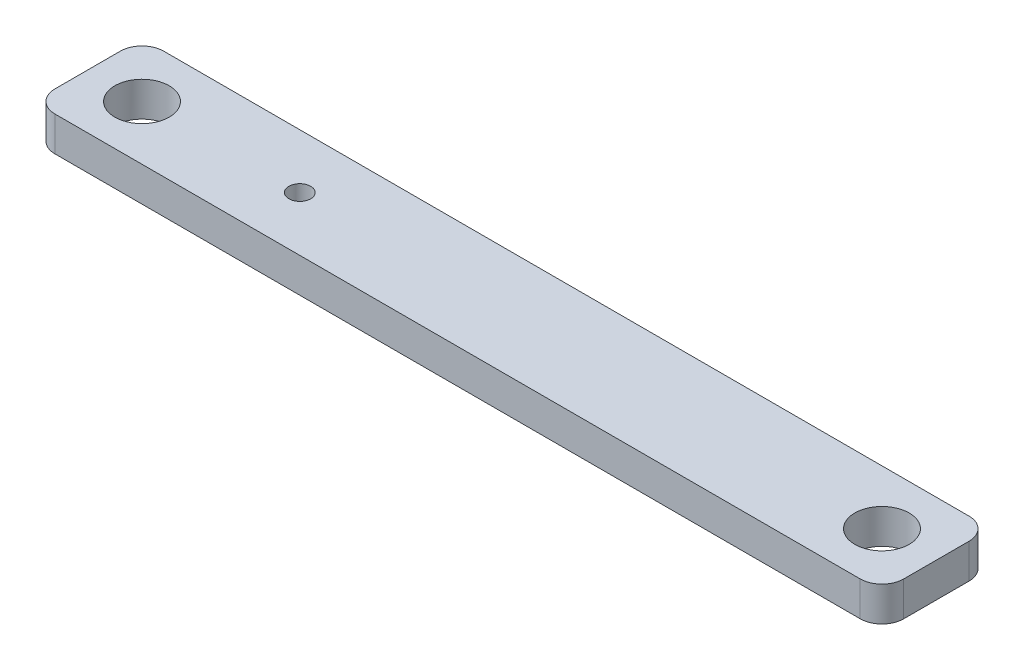
from build123d import *

# Parameters (mm, degrees)
SKETCH2_W           = 78
SKETCH2_H           = 10
BOSS_EXTRUDE1_DEPTH = 3.175
SKETCH3_R           = 2.5
CUT_EXTRUDE1_DEPTH  = 3.175
CUT_EXTRUDE2_REACH  = 41.447
SKETCH4_R           = 1
FILLET1_R           = 2


with BuildPart() as part:
    # Sketch2 → Boss-Extrude1 (new body)
    with BuildSketch(Plane(origin=(0, 0, 0), x_dir=(1, 0, 0), z_dir=(0, 1, 0))):
        Rectangle(SKETCH2_W, SKETCH2_H)
    extrude(amount=BOSS_EXTRUDE1_DEPTH)

    # Sketch3 → Cut-Extrude1 (cut)
    with BuildSketch(Plane(origin=(0, 3.175, 0), x_dir=(1, 0, 0), z_dir=(0, 1, 0))):
        with Locations(Location((-34, 0, 0), (0, 0, 270))):
            Circle(SKETCH3_R)
        with Locations(Location((34, 0, 0), (0, 0, 90))):
            Circle(SKETCH3_R)
    extrude(amount=-CUT_EXTRUDE1_DEPTH, mode=Mode.SUBTRACT)

    # Sketch4 → Cut-Extrude2 (cut, up to next)
    with BuildSketch(Plane(origin=(0, 3.175, 0), x_dir=(1, 0, 0), z_dir=(0, 1, 0)), mode=Mode.PRIVATE) as cut_extrude2_sk1:
        with Locations(Location((-19.5, 0, 0), (0, 0, 270))):
            Circle(SKETCH4_R)
    cut_extrude2_tool1 = extrude(cut_extrude2_sk1.sketch, amount=-CUT_EXTRUDE2_REACH, mode=Mode.PRIVATE) & part.part
    add(cut_extrude2_tool1.solids().sort_by_distance((-19.5, 3.175, 0))[0], mode=Mode.SUBTRACT)

    # Fillet1
    fillet1_edges = [part.edges().sort_by_distance(p)[0] for p in [
        (39, 1.5875, 5),
        (-39, 1.5875, 5),
        (-39, 1.5875, -5),
        (39, 1.5875, -5),
    ]]
    fillet(fillet1_edges, radius=FILLET1_R)


solid = part.part
